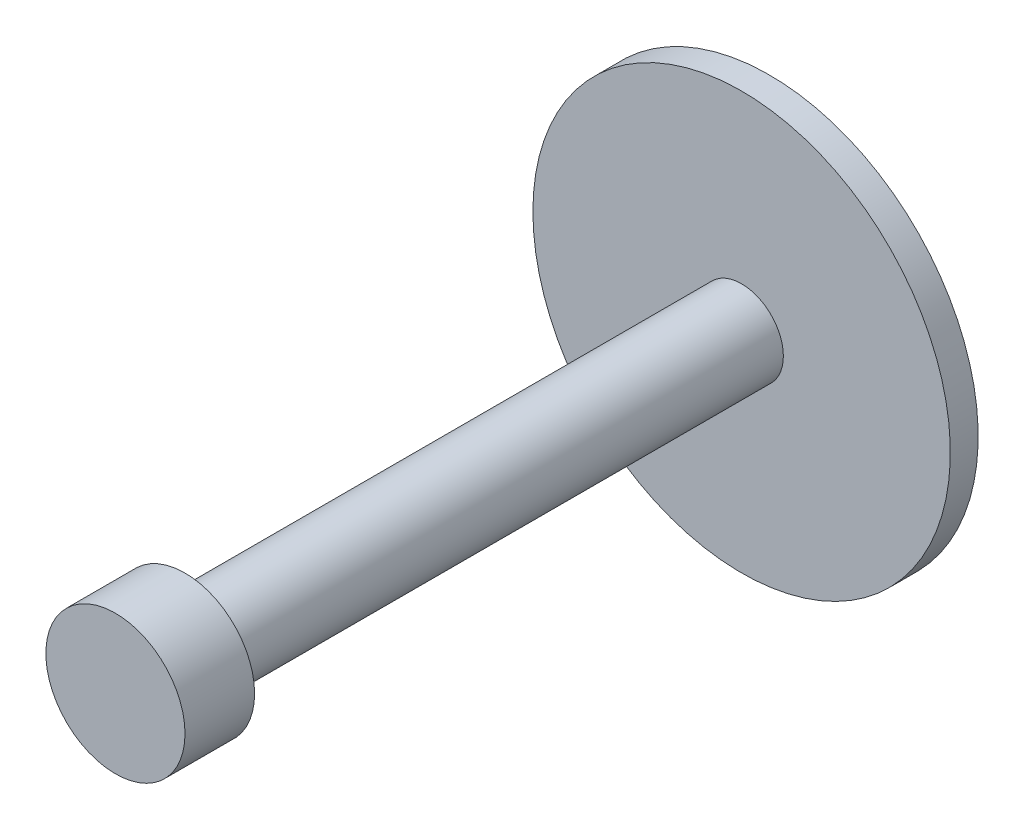
from build123d import *

# Parameters (mm, degrees)
SKETCH1_R           = 15
BOSS_EXTRUDE1_DEPTH = 200
SKETCH2_R           = 25
BOSS_EXTRUDE2_DEPTH = 25
SKETCH3_R           = 75
BOSS_EXTRUDE3_DEPTH = 10
SKETCH4_R           = 7.5
CUT_EXTRUDE1_DEPTH  = 1


with BuildPart() as part:
    # Sketch1 → Boss-Extrude1 (new body)
    with BuildSketch(Plane.XY):
        Circle(SKETCH1_R)
    extrude(amount=BOSS_EXTRUDE1_DEPTH)

    # Sketch2 → Boss-Extrude2 (add)
    with BuildSketch(Plane.XY.offset(200)):
        Circle(SKETCH2_R)
    extrude(amount=BOSS_EXTRUDE2_DEPTH)

    # Sketch3 → Boss-Extrude3 (add)
    with BuildSketch(Plane(origin=(0, 0, 0), x_dir=(-1, 0, 0), z_dir=(0, 0, -1))):
        Circle(SKETCH3_R)
    extrude(amount=BOSS_EXTRUDE3_DEPTH)

    # Sketch4 → Cut-Extrude1 (cut)
    with BuildSketch(Plane(origin=(0, 0, -10), x_dir=(-1, 0, 0), z_dir=(0, 0, -1))):
        with Locations((0, 30)):
            Circle(SKETCH4_R)
        with Locations((0, -30)):
            Circle(SKETCH4_R)
    extrude(amount=-CUT_EXTRUDE1_DEPTH, mode=Mode.SUBTRACT)


solid = part.part
